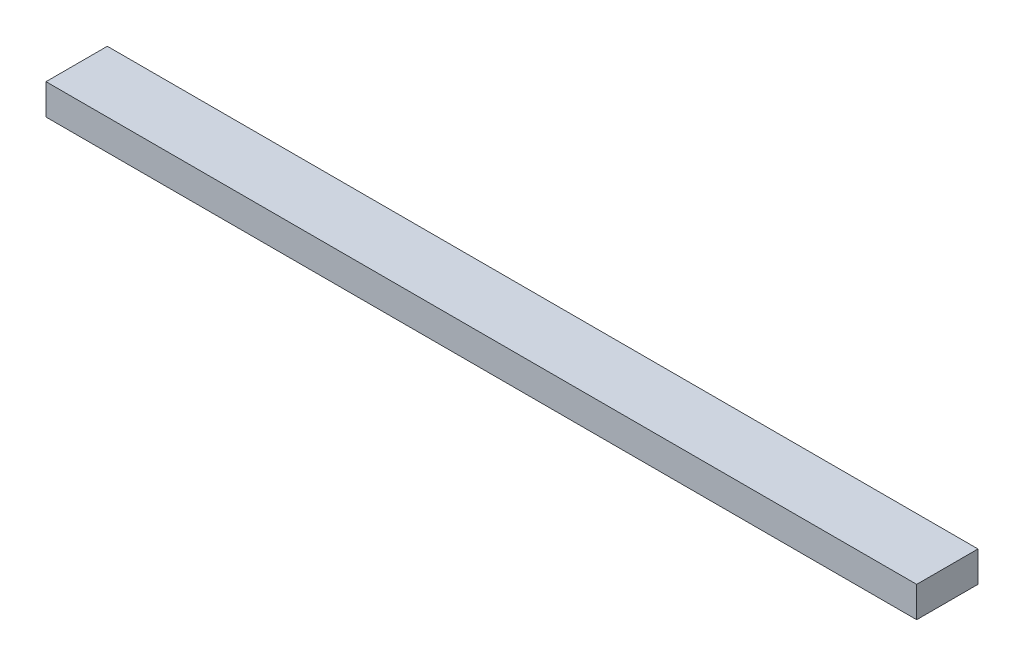
from build123d import *

# Parameters (mm, degrees)
SKETCH1_W           = 71
SKETCH1_H           = 5
BOSS_EXTRUDE1_DEPTH = 2.5


with BuildPart() as part:
    # Sketch1 → Boss-Extrude1 (new body)
    with BuildSketch(Plane(origin=(0, 0, 0), x_dir=(1, 0, 0), z_dir=(0, 1, 0))):
        with Locations((35.5, 2.5)):
            Rectangle(SKETCH1_W, SKETCH1_H)
    extrude(amount=BOSS_EXTRUDE1_DEPTH)


solid = part.part
